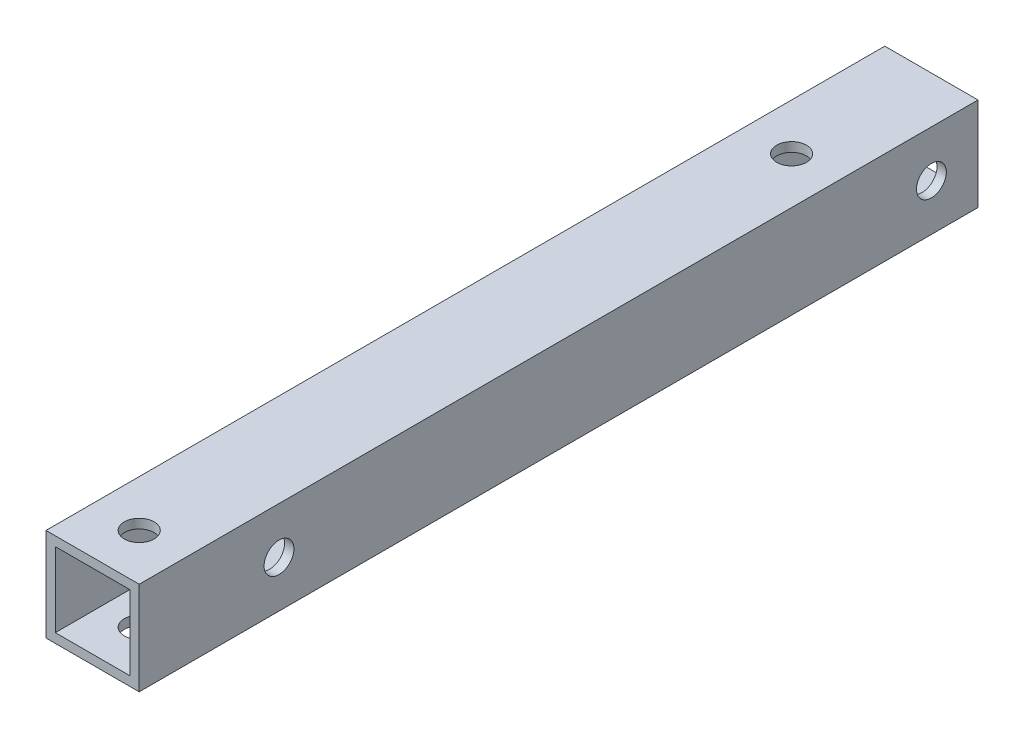
from build123d import *

# Parameters (mm, degrees)
SKETCH_1_W          = 10
SKETCH_1_H          = 10
SKETCH_1_W_2        = 8
SKETCH_1_H_2        = 8
EXTRUDE_1_DEPTH     = 90
SKETCH_2_R          = 1.6
CUT_EXTRUDE_1_DEPTH = 91.691785736
SKETCH_3_R          = 1.6
CUT_EXTRUDE_2_DEPTH = 91.691785736


with BuildPart() as part:
    # ｽｹｯﾁ1 → ﾎﾞｽ - 押し出し1 (new body)
    with BuildSketch(Plane.XY):
        Rectangle(SKETCH_1_W, SKETCH_1_H)
        Rectangle(SKETCH_1_W_2, SKETCH_1_H_2, mode=Mode.SUBTRACT)
    extrude(amount=EXTRUDE_1_DEPTH)

    # ｽｹｯﾁ2 → ｶｯﾄ - 押し出し1 (cut, through all)
    with BuildSketch(Plane(origin=(5, 0, 0), x_dir=(0, 0, -1), z_dir=(1, 0, 0))):
        with Locations(Location((-75, 0, 0), (0, 0, 90))):
            Circle(SKETCH_2_R)
        with Locations(Location((-5, 0, 0), (0, 0, 90))):
            Circle(SKETCH_2_R)
    extrude(amount=-CUT_EXTRUDE_1_DEPTH, mode=Mode.SUBTRACT)

    # ｽｹｯﾁ3 → ｶｯﾄ - 押し出し2 (cut, through all)
    with BuildSketch(Plane(origin=(0, 5, 0), x_dir=(1, 0, 0), z_dir=(0, 1, 0))):
        with Locations(Location((0, -15, 0), (0, 0, 270))):
            Circle(SKETCH_3_R)
        with Locations(Location((0, -85, 0), (0, 0, 270))):
            Circle(SKETCH_3_R)
    extrude(amount=-CUT_EXTRUDE_2_DEPTH, mode=Mode.SUBTRACT)


solid = part.part
